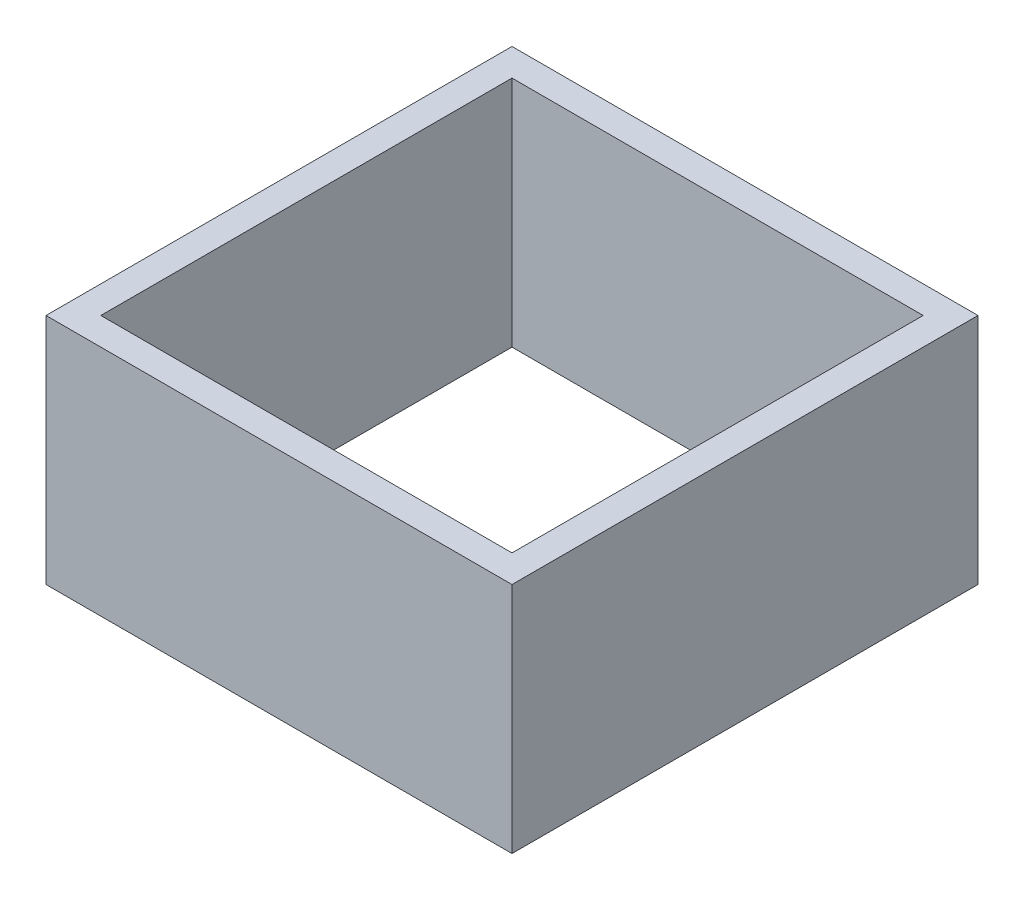
from build123d import *

# Parameters (mm, degrees)
SKETCH1_W           = 170
SKETCH1_H           = 170
BOSS_EXTRUDE1_DEPTH = 85
SKETCH2_W           = 150
SKETCH2_H           = 150
CUT_EXTRUDE1_DEPTH  = 85


with BuildPart() as part:
    # Sketch1 → Boss-Extrude1 (new body)
    with BuildSketch(Plane(origin=(0, 0, 0), x_dir=(1, 0, 0), z_dir=(0, 1, 0))):
        Rectangle(SKETCH1_W, SKETCH1_H)
    extrude(amount=BOSS_EXTRUDE1_DEPTH)

    # Sketch2 → Cut-Extrude1 (cut)
    with BuildSketch(Plane(origin=(0, 85, 0), x_dir=(1, 0, 0), z_dir=(0, 1, 0))):
        Rectangle(SKETCH2_W, SKETCH2_H)
    extrude(amount=-CUT_EXTRUDE1_DEPTH, mode=Mode.SUBTRACT)


solid = part.part
